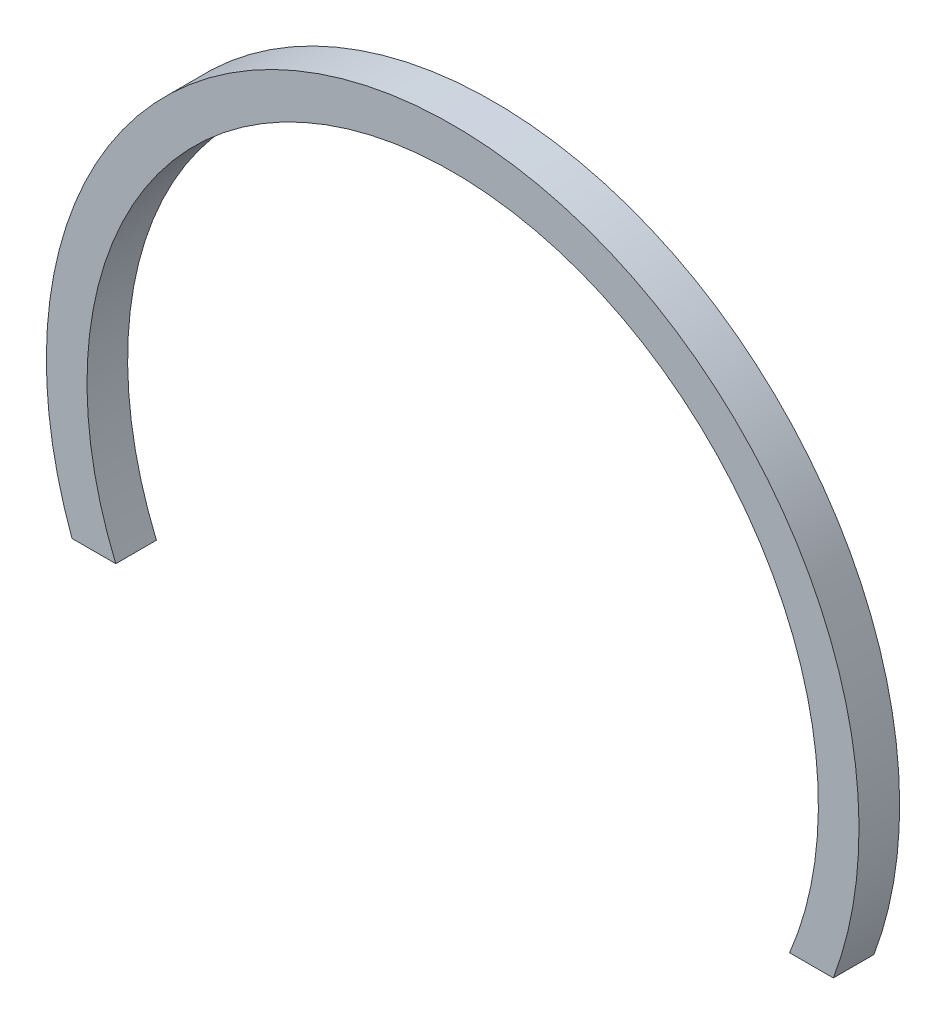
from build123d import *

# Parameters (mm, degrees)
SKETCH1_R                             = 30
ARCH_OUTER_DEPTH                      = 3
WHEEL_CLEARANCE_R27_START             = -0.1
SKETCH2_R                             = 27
WHEEL_CLEARANCE_R27_DEPTH             = 3.2
OPEN_BOTTOM_AT_GROUND_CLEARANCE_START = -0.1
SKETCH3_W                             = 62
SKETCH3_H                             = 20.5
OPEN_BOTTOM_AT_GROUND_CLEARANCE_DEPTH = 3.2


with BuildPart() as part:
    # Sketch1 → Arch_Outer (new body)
    with BuildSketch(Plane.XY):
        Circle(SKETCH1_R)
    extrude(amount=ARCH_OUTER_DEPTH)

    # Sketch2 → Wheel_Clearance_R27 (cut)
    with BuildSketch(Plane.XY.offset(WHEEL_CLEARANCE_R27_START)):
        Circle(SKETCH2_R)
    extrude(amount=WHEEL_CLEARANCE_R27_DEPTH, mode=Mode.SUBTRACT)

    # Sketch3 → Open_Bottom_At_Ground_Clearance (cut)
    with BuildSketch(Plane.XY.offset(OPEN_BOTTOM_AT_GROUND_CLEARANCE_START)):
        with Locations((0, -20.75)):
            Rectangle(SKETCH3_W, SKETCH3_H)
    extrude(amount=OPEN_BOTTOM_AT_GROUND_CLEARANCE_DEPTH, mode=Mode.SUBTRACT)


solid = part.part
